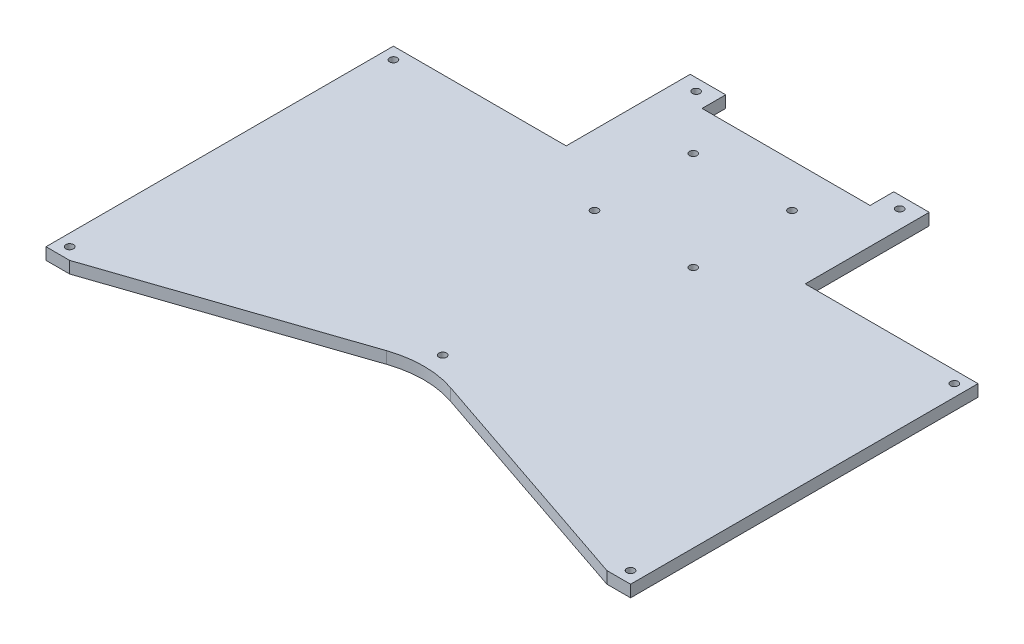
from build123d import *

# Parameters (mm, degrees)
BOSS_EXTRU_1_DEPTH      = 5
ESQUISSE2_R             = 1.6
ENL_V_MAT_EXTRU_1_DEPTH = 209.56953277


with BuildPart() as part:
    # Esquisse1 → Boss.-Extru.1 (new body)
    with BuildSketch(Plane(origin=(0, 0, 0), x_dir=(1, 0, 0), z_dir=(0, 1, 0))):
        with BuildLine():
            Line((-50.5, 31.2), (-35.5, 31.2))
            Line((-35.5, 31.2), (-35.5, 21.2))
            Line((-35.5, 21.2), (35.5, 21.2))
            Line((35.5, 21.2), (35.5, 31.2))
            Line((35.5, 31.2), (50.5, 31.2))
            Line((50.5, 31.2), (50.5, -21.2))
            Line((50.5, -21.2), (123.5, -21.2))
            Line((123.5, -21.2), (123.5, -168))
            Line((123.5, -168), (113.5, -168))
            Line((113.5, -168), (13.488258165, -134.084795517))
            ThreePointArc((13.488258165, -134.084795517), (0, -131.86), (-13.488258165, -134.084795517))
            Line((-13.488258165, -134.084795517), (-113.5, -168))
            Line((-113.5, -168), (-123.5, -168))
            Line((-123.5, -168), (-123.5, -21.2))
            Line((-123.5, -21.2), (-50.5, -21.2))
            Line((-50.5, -21.2), (-50.5, 31.2))
        make_face()
    extrude(amount=BOSS_EXTRU_1_DEPTH)

    # Esquisse2 → Enlèv. mat.-Extru.1 (cut, through all)
    with BuildSketch(Plane.XZ):
        with Locations(Location((-118.5, 163, 0), (0, 0, 270))):
            Circle(ESQUISSE2_R)
        with Locations(Location((118.5, 163, 0), (0, 0, 270))):
            Circle(ESQUISSE2_R)
        with Locations(Location((118.5, 26.2, 0), (0, 0, 270))):
            Circle(ESQUISSE2_R)
        with Locations(Location((-118.5, 26.2, 0), (0, 0, 270))):
            Circle(ESQUISSE2_R)
        with Locations(Location((43, -26.2, 0), (0, 0, 270))):
            Circle(ESQUISSE2_R)
        with Locations(Location((-43, -26.2, 0), (0, 0, 270))):
            Circle(ESQUISSE2_R)
        with Locations(Location((20.859650045, 38.859650045, 0), (0, 0, 270))):
            Circle(ESQUISSE2_R)
        with Locations(Location((-20.859650045, 38.859650045, 0), (0, 0, 270))):
            Circle(ESQUISSE2_R)
        with Locations(Location((-20.859650045, -2.859650045, 0), (0, 0, 270))):
            Circle(ESQUISSE2_R)
        with Locations(Location((20.859650045, -2.859650045, 0), (0, 0, 270))):
            Circle(ESQUISSE2_R)
        with Locations(Location((0, 123.86, 0), (0, 0, 270))):
            Circle(ESQUISSE2_R)
    extrude(amount=-ENL_V_MAT_EXTRU_1_DEPTH, mode=Mode.SUBTRACT)


solid = part.part
